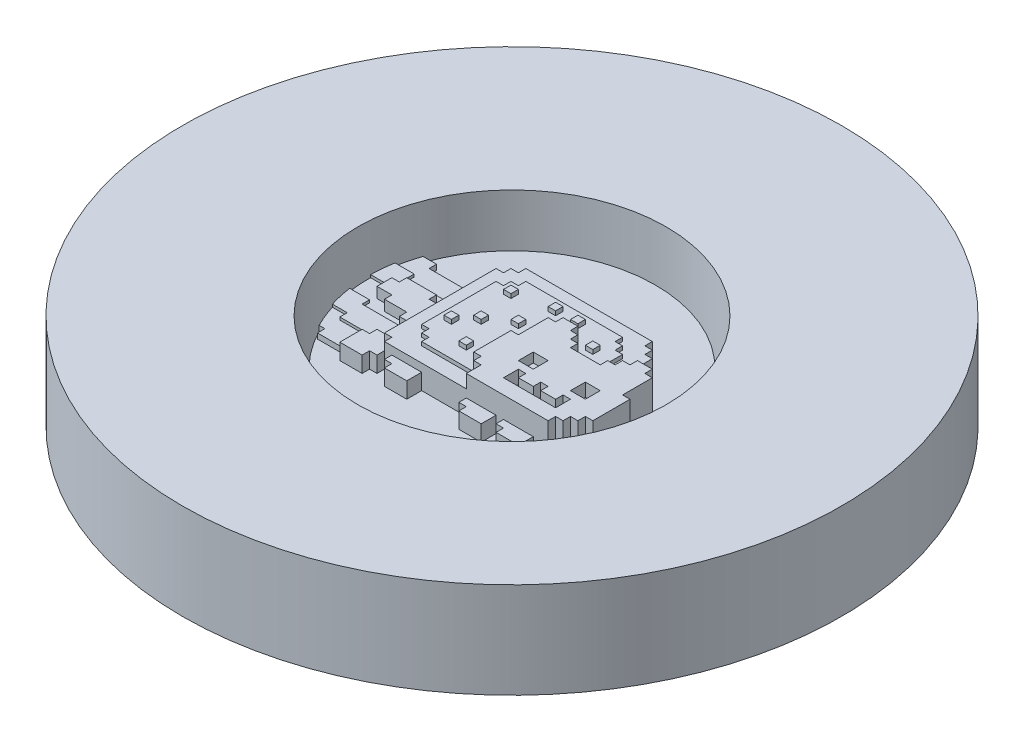
from build123d import *
from build123d.topology import SkipClean

# Parameters (mm, degrees)
FACE_3_W            = 7.112
FACE_3_H            = 7.112
FACE_2_DEPTH        = 17.78
FEETTAIL_DEPTH      = 7.62
POPTART_DEPTH       = 11.43
SPRINKLES_W         = 3.556
SPRINKLES_H         = 3.556
SPRINKLE_DEPTH      = 15.24
ENGRAVE_DEPTH       = 13.208
SKETCH2_R           = 68.58
CUPCAKE_DEPTH       = 15.24
RETAINING_START     = 21.59
SKETCH4_R           = 157.48
SKETCH4_R_2         = 73.66
RETAINING_DEPTH     = 45.72
CUPCAKE_START       = -17.78
SKETCH5_R           = 81.28
CUPCAKE_BODY_DEPTH  = 6.35
BOSS_EXTRUDE1_DEPTH = 2.54
BOSS_EXTRUDE2_DEPTH = 3.81


with BuildPart() as part:
    # face 3 → face 2 (new body)
    with BuildSketch(Plane(origin=(0, 0, 0), x_dir=(1, 0, 0), z_dir=(0, 1, 0))):
        Polygon((103.124, 88.9), (110.236, 88.9), (110.236, 85.344), (113.792, 85.344), (113.792, 81.788), (117.348, 81.788), (117.348, 78.232), (131.572, 78.232), (131.572, 81.788), (135.128, 81.788), (135.128, 85.344), (138.684, 85.344), (138.684, 88.9), (145.796, 88.9), (145.796, 85.344), (149.352, 85.344), (149.352, 71.12), (152.908, 71.12), (152.908, 53.34), (149.352, 53.34), (149.352, 49.784), (145.796, 49.784), (145.796, 46.228), (142.24, 46.228), (142.24, 42.672), (103.124, 42.672), (103.124, 49.784), (99.568, 49.784), (99.568, 53.34), (96.012, 53.34), (96.012, 71.12), (99.568, 71.12), (99.568, 85.344), (103.124, 85.344), align=None)
        with Locations((113.792, 64.008)):
            Rectangle(FACE_3_W, FACE_3_H, mode=Mode.SUBTRACT)
        with Locations((138.684, 64.008)):
            Rectangle(FACE_3_W, FACE_3_H, mode=Mode.SUBTRACT)
        Polygon((113.792, 56.896), (113.792, 49.784), (138.684, 49.784), (138.684, 56.896), (135.128, 56.896), (135.128, 53.34), (128.016, 53.34), (128.016, 56.896), (124.46, 56.896), (124.46, 53.34), (117.348, 53.34), (117.348, 56.896), align=None, mode=Mode.SUBTRACT)
    extrude(amount=FACE_2_DEPTH)

    # feet tail → feettail (add)
    with BuildSketch(Plane(origin=(0, 0, 0), x_dir=(1, 0, 0), z_dir=(0, 1, 0))):
        Polygon((60.452, 74.676), (53.34, 74.676), (53.34, 78.232), (39.116, 78.232), (39.116, 74.676), (35.56, 74.676), (35.56, 67.564), (42.672, 67.564), (42.672, 64.008), (53.34, 64.008), (53.34, 60.452), (60.452, 60.452), align=None)
        Polygon((60.452, 53.34), (56.896, 53.34), (56.896, 49.784), (53.34, 49.784), (53.34, 46.228), (49.784, 46.228), (49.784, 35.56), (60.452, 35.56), (60.452, 39.116), (64.008, 39.116), (64.008, 46.228), (60.452, 46.228), align=None)
        Polygon((67.564, 42.672), (67.564, 39.116), (71.12, 39.116), (71.12, 35.56), (81.788, 35.56), (81.788, 42.672), align=None)
        Polygon((103.124, 42.672), (103.124, 39.116), (106.68, 39.116), (106.68, 35.56), (117.348, 35.56), (117.348, 42.672), align=None)
        Polygon((120.904, 42.672), (120.904, 39.116), (124.46, 39.116), (124.46, 35.56), (135.128, 35.56), (135.128, 42.672), align=None)
    extrude(amount=FEETTAIL_DEPTH)


with BuildPart() as feettail_piece_1:
    # of the separate pieces the step leaves, piece 1, a body of its own (feettail_pieces)
    add(part.part.solids().sort_by_distance((103.124, 0, -88.9))[0])



with BuildPart() as feettail_piece_2:
    # of the separate pieces the step leaves, piece 2, a body of its own (feettail_pieces)
    add(part.part.solids().sort_by_distance((60.452, 0, -74.676))[0])


with BuildPart() as feettail_piece_3:
    # of the separate pieces the step leaves, piece 3, a body of its own (feettail_pieces)
    add(part.part.solids().sort_by_distance((60.452, 0, -53.34))[0])


with BuildPart() as feettail_piece_4:
    # of the separate pieces the step leaves, piece 4, a body of its own (feettail_pieces)
    add(part.part.solids().sort_by_distance((67.564, 0, -42.672))[0])


with BuildPart() as feettail_piece_1_1:
    add(feettail_piece_1.part)

    add(feettail_piece_3.part)  # poptart merges feettail piece 3

    add(feettail_piece_4.part)  # poptart merges feettail piece 4
    # poptart 2 → poptart (add)
    with BuildSketch(Plane(origin=(0, 0, 0), x_dir=(1, 0, 0), z_dir=(0, 1, 0))):
        Polygon((135.128, 99.568), (131.572, 99.568), (131.572, 103.124), (128.016, 103.124), (128.016, 106.68), (67.564, 106.68), (67.564, 103.124), (64.008, 103.124), (64.008, 99.568), (60.452, 99.568), (60.452, 46.228), (64.008, 46.228), (64.008, 42.672), (135.128, 42.672), (145.796, 53.34), (145.796, 71.12), (135.128, 85.344), align=None)
    extrude(amount=POPTART_DEPTH)

    # sprinkles → sprinkle (add)
    with BuildSketch(Plane(origin=(0, 0, 0), x_dir=(1, 0, 0), z_dir=(0, 1, 0))):
        with Locations((72.898, 65.786)):
            Rectangle(SPRINKLES_W, SPRINKLES_H)
        with Locations((80.01, 72.898)):
            Rectangle(SPRINKLES_W, SPRINKLES_H)
        with Locations((90.678, 80.01)):
            Rectangle(SPRINKLES_W, SPRINKLES_H)
        with Locations((76.454, 90.678)):
            Rectangle(SPRINKLES_W, SPRINKLES_H)
        with Locations((94.234, 94.234)):
            Rectangle(SPRINKLES_W, SPRINKLES_H)
        with Locations((104.902, 94.234)):
            Rectangle(SPRINKLES_W, SPRINKLES_H)
        with Locations((119.126, 87.122)):
            Rectangle(SPRINKLES_W, SPRINKLES_H)
        with Locations((87.122, 58.674)):
            Rectangle(SPRINKLES_W, SPRINKLES_H)
    extrude(amount=SPRINKLE_DEPTH)

    # engrave poptart → engrave (add)
    with BuildSketch(Plane(origin=(0, 0, 0), x_dir=(1, 0, 0), z_dir=(0, 1, 0))):
        Polygon((71.12, 53.34), (74.676, 53.34), (74.676, 49.784), (99.816268886, 49.760009936), (99.568, 49.784), (128.016, 64.008), (128.016, 67.564), (128.016, 92.456), (124.46, 92.456), (124.46, 96.012), (120.904, 96.012), (120.904, 99.568), (74.676, 99.568), (74.676, 96.012), (71.12, 96.012), (71.12, 92.456), (67.564, 92.456), (67.564, 56.896), (71.12, 56.896), align=None)
    extrude(amount=ENGRAVE_DEPTH)


    add(feettail_piece_2.part)  # CUPCAKE merges feettail piece 2
    # Sketch2 → CUPCAKE (add)
    with BuildSketch(Plane(origin=(0, 0, 0), x_dir=(1, 0, 0), z_dir=(0, 1, 0))):
        with Locations(Location((93.98, 73.66, 0), (0, 0, 270))):
            Circle(SKETCH2_R)
    extrude(amount=-CUPCAKE_DEPTH)

    # Sketch10 → Boss-Extrude1 (add)
    with SkipClean():  # the faces are left unmerged after this step: merging them gives an invalid solid
        with BuildSketch(Plane(origin=(0, 0, 0), x_dir=(1, 0, 0), z_dir=(0, 1, 0))):
            with BuildLine():
                Line((60.452, 92.456), (35.56, 92.456))
                Line((35.56, 92.456), (35.56, 96.012))
                Line((35.56, 96.012), (29.14478969, 96.012))
                ThreePointArc((29.14478969, 96.012), (27.559188352, 90.733142065), (26.402632901, 85.344))
                Line((26.402632901, 85.344), (35.56, 85.344))
                Line((35.56, 85.344), (35.56, 81.788))
                Line((35.56, 81.788), (60.452, 81.788))
                Line((60.452, 81.788), (60.452, 92.456))
            make_face()
            with BuildLine():
                Line((35.56, 74.676), (25.407526339, 74.676))
                ThreePointArc((25.407526339, 74.676), (25.53690436, 69.328827045), (26.082612009, 64.008))
                Line((26.082612009, 64.008), (35.56, 64.008))
                Line((35.56, 64.008), (35.56, 60.452))
                Line((35.56, 60.452), (53.34, 60.452))
                Line((53.34, 60.452), (53.34, 64.008))
                Line((53.34, 64.008), (42.672, 64.008))
                Line((42.672, 64.008), (42.672, 67.564))
                Line((42.672, 67.564), (35.56, 67.564))
                Line((35.56, 67.564), (35.56, 74.676))
            make_face()
            with BuildLine():
                Line((53.34, 49.784), (35.56, 49.784))
                Line((35.56, 49.784), (35.56, 53.34))
                Line((35.56, 53.34), (28.479511452, 53.34))
                ThreePointArc((28.479511452, 53.34), (30.415690351, 47.915195887), (32.800262701, 42.672))
                Line((32.800262701, 42.672), (35.56, 42.672))
                Line((35.56, 42.672), (35.56, 39.116))
                Line((35.56, 39.116), (49.784, 39.116))
                Line((49.784, 39.116), (49.784, 46.228))
                Line((49.784, 46.228), (53.34, 46.228))
                Line((53.34, 46.228), (53.34, 49.784))
            make_face()
        extrude(amount=BOSS_EXTRUDE1_DEPTH)

    # Sketch11 → Boss-Extrude2 (add)
    with SkipClean():  # the faces are left unmerged after this step: merging them gives an invalid solid
        with BuildSketch(Plane(origin=(0, 0, 0), x_dir=(1, 0, 0), z_dir=(0, 1, 0))):
            with BuildLine():
                Line((26.082612009, 64.008), (35.56, 64.008))
                Line((35.56, 64.008), (35.56, 60.452))
                Line((35.56, 60.452), (60.452, 60.452))
                Line((60.452, 60.452), (60.452, 53.34))
                Line((60.452, 53.34), (56.896, 53.34))
                Line((56.896, 53.34), (56.896, 49.784))
                Line((56.896, 49.784), (35.56, 49.784))
                Line((35.56, 49.784), (35.56, 53.34))
                Line((35.56, 53.34), (28.479511452, 53.34))
                ThreePointArc((28.479511452, 53.34), (27.068118228, 58.62615559), (26.082612009, 64.008))
            make_face()
            with BuildLine():
                Line((60.452, 81.788), (60.452, 74.676))
                Line((60.452, 74.676), (53.34, 74.676))
                Line((53.34, 74.676), (53.34, 78.232))
                Line((53.34, 78.232), (39.116, 78.232))
                Line((39.116, 78.232), (39.116, 74.676))
                Line((39.116, 74.676), (25.407526339, 74.676))
                ThreePointArc((25.407526339, 74.676), (25.696427007, 80.029463028), (26.402632901, 85.344))
                Line((26.402632901, 85.344), (35.56, 85.344))
                Line((35.56, 85.344), (35.56, 81.788))
                Line((35.56, 81.788), (60.452, 81.788))
            make_face()
        extrude(amount=BOSS_EXTRUDE2_DEPTH)


with BuildPart() as body_2:
    # Sketch4 → retaining (new body)
    with BuildSketch(Plane(origin=(0, 0, 0), x_dir=(1, 0, 0), z_dir=(0, 1, 0)).offset(RETAINING_START)):
        with Locations(Location((93.98, 73.66, 0), (0, 0, 270))):
            Circle(SKETCH4_R)
        with Locations(Location((93.98, 73.66, 0), (0, 0, 270))):
            Circle(SKETCH4_R_2, mode=Mode.SUBTRACT)
    extrude(amount=-RETAINING_DEPTH)


with BuildPart() as body_3:
    # Sketch5 → cupcake body (new body)
    with BuildSketch(Plane(origin=(0, 0, 0), x_dir=(1, 0, 0), z_dir=(0, 1, 0)).offset(CUPCAKE_START)):
        with Locations(Location((93.98, 73.66, 0), (0, 0, 270))):
            Circle(SKETCH5_R)
    extrude(amount=-CUPCAKE_BODY_DEPTH)


solid = Compound([feettail_piece_1_1.part, body_2.part, body_3.part])
